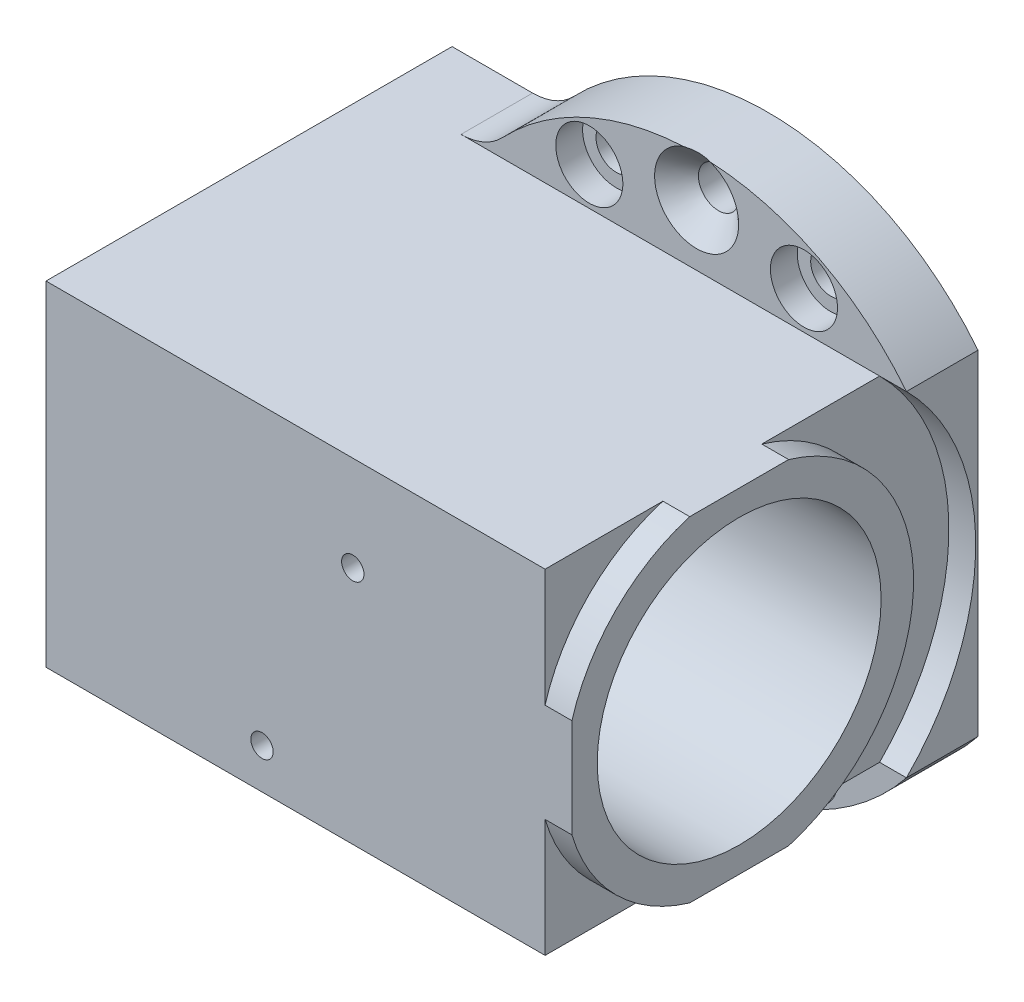
from build123d import *

# Parameters (mm, degrees)
BOSS_EXTRUDE1_DEPTH                                 = 8
CUT_EXTRUDE1_REACH                                  = 65.856
SKETCH4_W                                           = 55.8
SKETCH4_H                                           = 37.4
BOSS_EXTRUDE2_DEPTH                                 = 37.4
BOSS_EXTRUDE3_DEPTH                                 = 3
CUT_EXTRUDE2_START                                  = -3
CUT_EXTRUDE2_DEPTH                                  = 3
CUT_EXTRUDE3_START                                  = -3
CUT_EXTRUDE3_DEPTH                                  = 3
CSK_FOR_8_FLAT_HEAD_MACHINE_SCREW_100_D             = 4.5
CSK_FOR_8_FLAT_HEAD_MACHINE_SCREW_100_CSINK_D       = 9.4
CSK_FOR_8_FLAT_HEAD_MACHINE_SCREW_100_CSINK_ANGLE   = 90
F_4_CLEARANCE_HOLE1_D                               = 3.3
F_4_CLEARANCE_HOLE1_DEPTH                           = 6
CBORE_FOR_8_BINDING_HEAD_MACHINE_SCREW1_D           = 4.5
CBORE_FOR_8_BINDING_HEAD_MACHINE_SCREW1_CBORE_D     = 7.5
CBORE_FOR_8_BINDING_HEAD_MACHINE_SCREW1_CBORE_DEPTH = 3
FILLET1_R                                           = 6.35
M3X0_5_TAPPED_HOLE1_D                               = 2.5
M3X0_5_TAPPED_HOLE1_DEPTH                           = 4
M3X0_5_TAPPED_HOLE1_TIP                             = 0.751075774
FILLET2_R                                           = 6.35
SKETCH_2_W                                          = 83.837241206
SKETCH_2_H                                          = 96.376350526
CUT_EXTRUDE_1_DEPTH                                 = 109.737053621


with BuildPart() as part:
    # Sketch1 → Boss-Extrude1 (new body)
    with BuildSketch(Plane.XY.offset(8)):
        with BuildLine():
            Line((-23.45868709, 18.7), (-23.45868709, -18.7))
            ThreePointArc((-23.45868709, -18.7), (0, -30), (23.45868709, -18.7))
            Line((23.45868709, -18.7), (35.34131291, -18.7))
            Line((35.34131291, -18.7), (35.34131291, 18.7))
            Line((35.34131291, 18.7), (23.45868709, 18.7))
            ThreePointArc((23.45868709, 18.7), (0, 30), (-23.45868709, 18.7))
        make_face()
    extrude(amount=-BOSS_EXTRUDE1_DEPTH)

    # Sketch3 → Cut-Extrude1 (cut, up to next)
    with BuildSketch(Plane(origin=(-20.45868709, 0, 0), x_dir=(0, 0, -1), z_dir=(1, 0, 0)), mode=Mode.PRIVATE) as cut_extrude1_sk1:
        with BuildLine():
            Line((-8, 18.7), (-8, -18.7))
            ThreePointArc((-8, -18.7), (-0.254206384, 0), (-8, 18.7))
        make_face()
    cut_extrude1_tool1 = extrude(cut_extrude1_sk1.sketch, amount=-CUT_EXTRUDE1_REACH, mode=Mode.PRIVATE) & part.part
    add(cut_extrude1_tool1.solids().sort_by_distance((-20.458687, 0, 4.859168))[0], mode=Mode.SUBTRACT)

    # Sketch4 → Boss-Extrude2 (add)
    with BuildSketch(Plane.XY.offset(8)):
        with Locations((7.44131291, 0)):
            Rectangle(SKETCH4_W, SKETCH4_H)
    extrude(amount=BOSS_EXTRUDE2_DEPTH)

    # Sketch5 → Boss-Extrude3 (add)
    with BuildSketch(Plane.ZY.offset(20.45868709)):
        with BuildLine():
            Line((21.171890016, 18.7), (45.4, 18.7))
            Line((45.4, 18.7), (45.4, -18.7))
            Line((45.4, -18.7), (21.171890016, -18.7))
            ThreePointArc((21.171890016, -18.7), (7.2, 0), (21.171890016, 18.7))
        make_face()
    extrude(amount=BOSS_EXTRUDE3_DEPTH)

    # Sketch6 → Cut-Extrude2 (cut)
    with BuildSketch(Plane.ZY.offset(23.45868709).offset(CUT_EXTRUDE2_START)):
        with BuildLine():
            Line((45.4, -18.7), (45.4, -5.528109984))
            ThreePointArc((45.4, -5.528109984), (40.488582233, -13.788582233), (32.228109984, -18.7))
            Line((32.228109984, -18.7), (45.4, -18.7))
        make_face()
    extrude(amount=CUT_EXTRUDE2_DEPTH, mode=Mode.SUBTRACT)

    # Sketch7 → Cut-Extrude3 (cut)
    with BuildSketch(Plane.ZY.offset(23.45868709).offset(CUT_EXTRUDE3_START)):
        with BuildLine():
            Line((45.4, 18.7), (32.228109984, 18.7))
            ThreePointArc((32.228109984, 18.7), (40.488582233, 13.788582233), (45.4, 5.528109984))
            Line((45.4, 5.528109984), (45.4, 18.7))
        make_face()
    extrude(amount=CUT_EXTRUDE3_DEPTH, mode=Mode.SUBTRACT)

    # Sketch8 → Cut-Revolve1 (revolve, cut)
    with BuildSketch(Plane.XY.offset(26.7)):
        Polygon((-23.45868709, 15.86865), (-23.45868709, 0), (35.34131291, 0), (35.34131291, 15.86865), (9.94131291, 15.86865), (9.94131291, 13.5), (1.94131291, 13.5), (1.94131291, 15.86865), align=None)
    revolve(axis=Axis((-23.45868709, 0, 26.7), (1, 0, 0)), mode=Mode.SUBTRACT)

    # CSK for #8 Flat Head Machine Screw (100)1 (through all)
    with Locations(Plane.XY.offset(8)):
        with Locations((0, 25.5), (0, -25.5)):
            CounterSinkHole(CSK_FOR_8_FLAT_HEAD_MACHINE_SCREW_100_D / 2, CSK_FOR_8_FLAT_HEAD_MACHINE_SCREW_100_CSINK_D / 2, counter_sink_angle=CSK_FOR_8_FLAT_HEAD_MACHINE_SCREW_100_CSINK_ANGLE)

    # #4 Clearance Hole1
    with Locations(Plane(origin=(0, -18.7, 0), x_dir=(-1, 0, 0), z_dir=(0, -1, 0))):
        with Locations((12.45868709, -39.4), (-29.44131291, -39.4), (-29.44131291, -5.9)):
            Hole(F_4_CLEARANCE_HOLE1_D / 2, depth=F_4_CLEARANCE_HOLE1_DEPTH)

    # CBORE for #8 Binding Head Machine Screw1 (through all)
    with Locations(Plane.XY.offset(8)):
        with Locations((12, 22.95), (-12, 22.95), (-12, -22.95), (12, -22.95)):
            CounterBoreHole(CBORE_FOR_8_BINDING_HEAD_MACHINE_SCREW1_D / 2, CBORE_FOR_8_BINDING_HEAD_MACHINE_SCREW1_CBORE_D / 2, CBORE_FOR_8_BINDING_HEAD_MACHINE_SCREW1_CBORE_DEPTH)

    # Fillet1
    fillet1_edges = [part.edges().sort_by_distance(p)[0] for p in [
        (23.45868709, 18.7, 4),
    ]]
    fillet(fillet1_edges, radius=FILLET1_R)

    # M3x0.5 Tapped Hole1
    with Locations(Plane(origin=(1.04131291, 8.07366885, 45.4), x_dir=(1, 0, 0), z_dir=(0, 0, 1))):
        with Locations((0, 0), (10.150400418, -22.272670952)):
            Hole(M3X0_5_TAPPED_HOLE1_D / 2, depth=M3X0_5_TAPPED_HOLE1_DEPTH)
            with Locations((0, 0, -(M3X0_5_TAPPED_HOLE1_DEPTH + M3X0_5_TAPPED_HOLE1_TIP / 2))):  # 118° drill point
                Cone(0, M3X0_5_TAPPED_HOLE1_D / 2, M3X0_5_TAPPED_HOLE1_TIP, mode=Mode.SUBTRACT)

    # Fillet2
    fillet2_edges = [part.edges().sort_by_distance(p)[0] for p in [
        (23.45868709, -18.7, 4),
    ]]
    fillet(fillet2_edges, radius=FILLET2_R)

    # 镜向2: part across plane


with BuildPart() as part_1:
    add(part.part)
    add(part.part.mirror(Plane(origin=(35.34131291, -18.7, 0), x_dir=(0, 0, 1), z_dir=(1, 0, 0))))

    # 草图2 → 切除-拉伸1 (cut, through all)
    with BuildSketch(Plane.XY.offset(45.4)):
        with Locations((-6.577307693, -2.074214889)):
            Rectangle(SKETCH_2_W, SKETCH_2_H)
    extrude(amount=-CUT_EXTRUDE_1_DEPTH, mode=Mode.SUBTRACT)


solid = part_1.part
